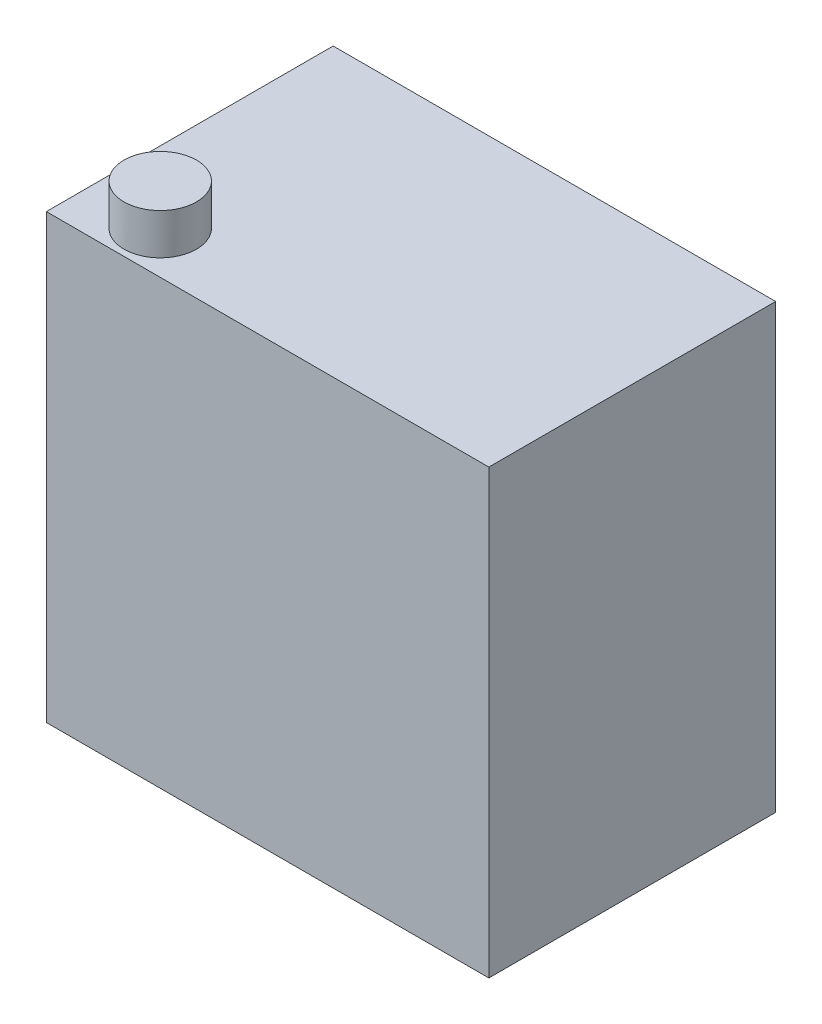
from build123d import *

# Parameters (mm, degrees)
SKETCH_1_W      = 108
SKETCH_1_H      = 108
EXTRUDE_1_DEPTH = 70
SKETCH_2_R      = 8.844496212
EXTRUDE_2_DEPTH = 10


with BuildPart() as part:
    # 草图1 → 拉伸1 (new body)
    with BuildSketch(Plane.XY):
        with Locations((54, 54)):
            Rectangle(SKETCH_1_W, SKETCH_1_H)
    extrude(amount=EXTRUDE_1_DEPTH)

    # 草图2 → 拉伸2 (add)
    with BuildSketch(Plane(origin=(0, 108, 0), x_dir=(-1, 0, 0), z_dir=(0, 1, 0))):
        with Locations(Location((-17.429342934, 59.635463546, 0), (0, 0, 270))):
            Circle(SKETCH_2_R)
    extrude(amount=EXTRUDE_2_DEPTH)


solid = part.part
